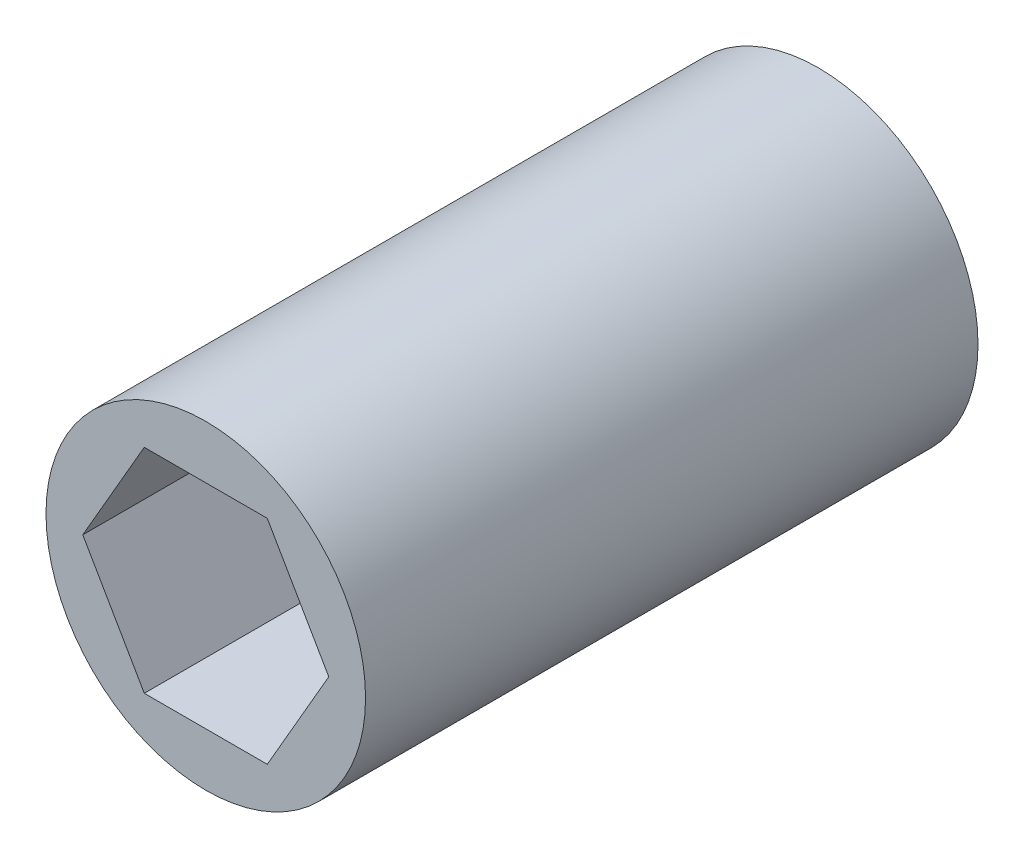
from build123d import *

# Parameters (mm, degrees)
SKETCH1_R           = 9.525
BOSS_EXTRUDE1_DEPTH = 18.25625


with BuildPart() as part:
    # Sketch1 → Boss-Extrude1 (new, symmetric)
    with BuildSketch(Plane.XY):
        Circle(SKETCH1_R)
        Polygon((7.332348419, 0), (3.666174209, 6.35), (-3.666174209, 6.35), (-7.332348419, 0), (-3.666174209, -6.35), (3.666174209, -6.35), align=None, mode=Mode.SUBTRACT)
    extrude(amount=BOSS_EXTRUDE1_DEPTH, both=True)


solid = part.part
